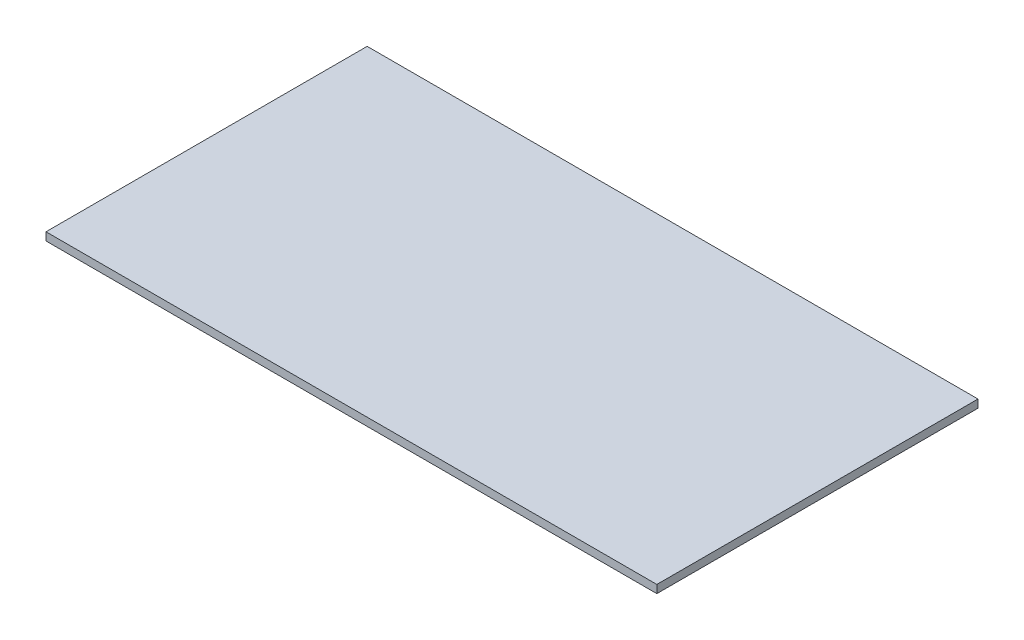
from build123d import *

# Parameters (mm, degrees)
SKETCH1_W           = 485
SKETCH1_H           = 255
BOSS_EXTRUDE1_DEPTH = 6.35


with BuildPart() as part:
    # Sketch1 → Boss-Extrude1 (new body)
    with BuildSketch(Plane(origin=(0, 0, 0), x_dir=(1, 0, 0), z_dir=(0, 1, 0))):
        with Locations((242.5, 127.5)):
            Rectangle(SKETCH1_W, SKETCH1_H)
    extrude(amount=BOSS_EXTRUDE1_DEPTH)


solid = part.part
